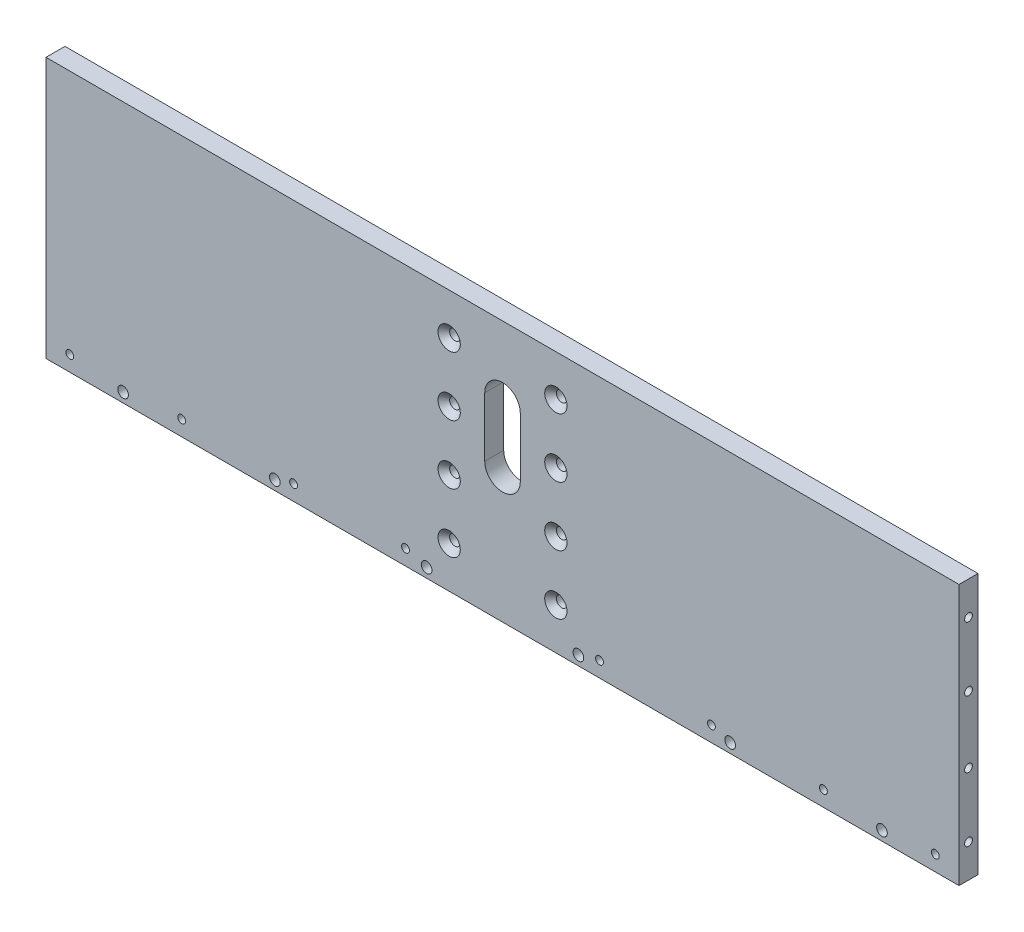
from build123d import *

# Parameters (mm, degrees)
SKETCH1_W                                       = 385
SKETCH1_H                                       = 110
EXTRUDE1_DEPTH                                  = 8
SKETCH2_R                                       = 2
CUT_EXTRUDE1_DEPTH                              = 10
CSK_FOR_M4_FLAT_HEAD_MACHINE_SCREW1_D           = 4.5
CSK_FOR_M4_FLAT_HEAD_MACHINE_SCREW1_CSINK_D     = 9.4
CSK_FOR_M4_FLAT_HEAD_MACHINE_SCREW1_CSINK_ANGLE = 90
SKETCH5_R                                       = 1.65
CUT_EXTRUDE2_DEPTH                              = 15
SKETCH6_R                                       = 2.25
CUT_EXTRUDE3_DEPTH                              = 10
CUT_EXTRUDE4_DEPTH                              = 6
CUT_EXTRUDE5_DEPTH                              = 10
CSK_FOR_M4_FLAT_HEAD_MACHINE_SCREW2_D           = 4.5
CSK_FOR_M4_FLAT_HEAD_MACHINE_SCREW2_CSINK_D     = 9.4
CSK_FOR_M4_FLAT_HEAD_MACHINE_SCREW2_CSINK_ANGLE = 90
SKETCH13_R                                      = 1.65
CUT_EXTRUDE6_DEPTH                              = 10


with BuildPart() as part:
    # Sketch1 → Extrude1 (new body)
    with BuildSketch(Plane.XY):
        Rectangle(SKETCH1_W, SKETCH1_H)
    extrude(amount=EXTRUDE1_DEPTH)

    # Sketch2 → Cut-Extrude1 (cut)
    with BuildSketch(Plane.XY.offset(8)):
        with Locations((22.5, 37.5)):
            Circle(SKETCH2_R)
        with Locations((22.5, 12.5)):
            Circle(SKETCH2_R)
        with Locations(Location((22.5, -12.5, 0), (0, 0, 180))):
            Circle(SKETCH2_R)
        with Locations((-22.5, -12.5)):
            Circle(SKETCH2_R)
        with Locations((-22.5, -37.5)):
            Circle(SKETCH2_R)
        with Locations(Location((22.5, -37.5, 0), (0, 0, 180))):
            Circle(SKETCH2_R)
        with Locations(Location((-22.5, 12.5, 0), (0, 0, 180))):
            Circle(SKETCH2_R)
        with Locations(Location((-22.5, 37.5, 0), (0, 0, 180))):
            Circle(SKETCH2_R)
    extrude(amount=-CUT_EXTRUDE1_DEPTH, mode=Mode.SUBTRACT)

    # CSK for M4 Flat Head Machine Screw1 (through all)
    with Locations(Plane.XY.offset(8)):
        with Locations((22.5, 37.5), (22.5, 12.5), (-22.5, 12.5), (-22.5, 37.5), (22.5, -12.5), (-22.5, -12.5), (-22.5, -37.5), (22.5, -37.5)):
            CounterSinkHole(CSK_FOR_M4_FLAT_HEAD_MACHINE_SCREW1_D / 2, CSK_FOR_M4_FLAT_HEAD_MACHINE_SCREW1_CSINK_D / 2, counter_sink_angle=CSK_FOR_M4_FLAT_HEAD_MACHINE_SCREW1_CSINK_ANGLE)

    # Sketch5 → Cut-Extrude2 (cut)
    with BuildSketch(Plane(origin=(192.5, 0, 0), x_dir=(0, 0, -1), z_dir=(1, 0, 0))):
        with Locations((-4, 41)):
            Circle(SKETCH5_R)
        with Locations((-4, 14)):
            Circle(SKETCH5_R)
        with Locations(Location((-4, -41, 0), (0, 0, 180))):
            Circle(SKETCH5_R)
        with Locations(Location((-4, -14, 0), (0, 0, 180))):
            Circle(SKETCH5_R)
    cut_extrude2 = extrude(amount=-CUT_EXTRUDE2_DEPTH, mode=Mode.SUBTRACT)

    # Mirror1: Cut-Extrude2 across plane
    add(cut_extrude2.mirror(Plane(origin=(0, 0, 0), x_dir=(0, 0, 1), z_dir=(1, 0, 0))), mode=Mode.SUBTRACT)

    # Sketch6 → Cut-Extrude3 (cut)
    with BuildSketch(Plane(origin=(0, 0, 0), x_dir=(-1, 0, 0), z_dir=(0, 0, -1))):
        with Locations((-96, -51)):
            Circle(SKETCH6_R)
        with Locations((-32, -51)):
            Circle(SKETCH6_R)
        with Locations((32, -51)):
            Circle(SKETCH6_R)
        with Locations((96, -51)):
            Circle(SKETCH6_R)
        with Locations((-160, -51)):
            Circle(SKETCH6_R)
        with Locations((160, -51)):
            Circle(SKETCH6_R)
    extrude(amount=-CUT_EXTRUDE3_DEPTH, mode=Mode.SUBTRACT)

    # Sketch9 → Cut-Extrude4 (cut)
    with BuildSketch(Plane(origin=(0, 0, 0), x_dir=(-1, 0, 0), z_dir=(0, 0, -1))):
        with BuildLine():
            Line((-162.5, 40), (-162.5, -40))
            ThreePointArc((-162.5, -40), (-167.5, -45), (-172.5, -40))
            Line((-172.5, -40), (-172.5, 40))
            ThreePointArc((-172.5, 40), (-167.5, 45), (-162.5, 40))
        make_face()
        with BuildLine():
            Line((-149.5, 40), (-149.5, -40))
            ThreePointArc((-149.5, -40), (-154.5, -45), (-159.5, -40))
            Line((-159.5, -40), (-159.5, 40))
            ThreePointArc((-159.5, 40), (-154.5, 45), (-149.5, 40))
        make_face()
        with BuildLine():
            Line((-136.5, 40), (-136.5, -40))
            ThreePointArc((-136.5, -40), (-141.5, -45), (-146.5, -40))
            Line((-146.5, -40), (-146.5, 40))
            ThreePointArc((-146.5, 40), (-141.5, 45), (-136.5, 40))
        make_face()
        with BuildLine():
            Line((-123.5, 40), (-123.5, -40))
            ThreePointArc((-123.5, -40), (-128.5, -45), (-133.5, -40))
            Line((-133.5, -40), (-133.5, 40))
            ThreePointArc((-133.5, 40), (-128.5, 45), (-123.5, 40))
        make_face()
        with BuildLine():
            Line((-110.5, 40), (-110.5, -40))
            ThreePointArc((-110.5, -40), (-115.5, -45), (-120.5, -40))
            Line((-120.5, -40), (-120.5, 40))
            ThreePointArc((-120.5, 40), (-115.5, 45), (-110.5, 40))
        make_face()
        with BuildLine():
            Line((-97.5, 40), (-97.5, -40))
            ThreePointArc((-97.5, -40), (-102.5, -45), (-107.5, -40))
            Line((-107.5, -40), (-107.5, 40))
            ThreePointArc((-107.5, 40), (-102.5, 45), (-97.5, 40))
        make_face()
        with BuildLine():
            Line((-84.5, 40), (-84.5, -40))
            ThreePointArc((-84.5, -40), (-89.5, -45), (-94.5, -40))
            Line((-94.5, -40), (-94.5, 40))
            ThreePointArc((-94.5, 40), (-89.5, 45), (-84.5, 40))
        make_face()
        with BuildLine():
            Line((-71.5, 40), (-71.5, -40))
            ThreePointArc((-71.5, -40), (-76.5, -45), (-81.5, -40))
            Line((-81.5, -40), (-81.5, 40))
            ThreePointArc((-81.5, 40), (-76.5, 45), (-71.5, 40))
        make_face()
        with BuildLine():
            Line((-58.5, 40), (-58.5, -40))
            ThreePointArc((-58.5, -40), (-63.5, -45), (-68.5, -40))
            Line((-68.5, -40), (-68.5, 40))
            ThreePointArc((-68.5, 40), (-63.5, 45), (-58.5, 40))
        make_face()
        with BuildLine():
            Line((-45.5, 40), (-45.5, -40))
            ThreePointArc((-45.5, -40), (-50.5, -45), (-55.5, -40))
            Line((-55.5, -40), (-55.5, 40))
            ThreePointArc((-55.5, 40), (-50.5, 45), (-45.5, 40))
        make_face()
        with BuildLine():
            Line((-32.5, 40), (-32.5, -40))
            ThreePointArc((-32.5, -40), (-37.5, -45), (-42.5, -40))
            Line((-42.5, -40), (-42.5, 40))
            ThreePointArc((-42.5, 40), (-37.5, 45), (-32.5, 40))
        make_face()
        with BuildLine():
            Line((162.5, 40), (162.5, -40))
            ThreePointArc((162.5, -40), (167.5, -45), (172.5, -40))
            Line((172.5, -40), (172.5, 40))
            ThreePointArc((172.5, 40), (167.5, 45), (162.5, 40))
        make_face()
        with BuildLine():
            Line((149.5, 40), (149.5, -40))
            ThreePointArc((149.5, -40), (154.5, -45), (159.5, -40))
            Line((159.5, -40), (159.5, 40))
            ThreePointArc((159.5, 40), (154.5, 45), (149.5, 40))
        make_face()
        with BuildLine():
            Line((136.5, 40), (136.5, -40))
            ThreePointArc((136.5, -40), (141.5, -45), (146.5, -40))
            Line((146.5, -40), (146.5, 40))
            ThreePointArc((146.5, 40), (141.5, 45), (136.5, 40))
        make_face()
        with BuildLine():
            Line((123.5, 40), (123.5, -40))
            ThreePointArc((123.5, -40), (128.5, -45), (133.5, -40))
            Line((133.5, -40), (133.5, 40))
            ThreePointArc((133.5, 40), (128.5, 45), (123.5, 40))
        make_face()
        with BuildLine():
            Line((110.5, 40), (110.5, -40))
            ThreePointArc((110.5, -40), (115.5, -45), (120.5, -40))
            Line((120.5, -40), (120.5, 40))
            ThreePointArc((120.5, 40), (115.5, 45), (110.5, 40))
        make_face()
        with BuildLine():
            Line((97.5, 40), (97.5, -40))
            ThreePointArc((97.5, -40), (102.5, -45), (107.5, -40))
            Line((107.5, -40), (107.5, 40))
            ThreePointArc((107.5, 40), (102.5, 45), (97.5, 40))
        make_face()
        with BuildLine():
            Line((84.5, 40), (84.5, -40))
            ThreePointArc((84.5, -40), (89.5, -45), (94.5, -40))
            Line((94.5, -40), (94.5, 40))
            ThreePointArc((94.5, 40), (89.5, 45), (84.5, 40))
        make_face()
        with BuildLine():
            Line((71.5, 40), (71.5, -40))
            ThreePointArc((71.5, -40), (76.5, -45), (81.5, -40))
            Line((81.5, -40), (81.5, 40))
            ThreePointArc((81.5, 40), (76.5, 45), (71.5, 40))
        make_face()
        with BuildLine():
            Line((58.5, 40), (58.5, -40))
            ThreePointArc((58.5, -40), (63.5, -45), (68.5, -40))
            Line((68.5, -40), (68.5, 40))
            ThreePointArc((68.5, 40), (63.5, 45), (58.5, 40))
        make_face()
        with BuildLine():
            Line((45.5, 40), (45.5, -40))
            ThreePointArc((45.5, -40), (50.5, -45), (55.5, -40))
            Line((55.5, -40), (55.5, 40))
            ThreePointArc((55.5, 40), (50.5, 45), (45.5, 40))
        make_face()
        with BuildLine():
            Line((32.5, 40), (32.5, -40))
            ThreePointArc((32.5, -40), (37.5, -45), (42.5, -40))
            Line((42.5, -40), (42.5, 40))
            ThreePointArc((42.5, 40), (37.5, 45), (32.5, 40))
        make_face()
    extrude(amount=-CUT_EXTRUDE4_DEPTH, mode=Mode.SUBTRACT)

    # Sketch10 → Cut-Extrude5 (cut)
    with BuildSketch(Plane.XY.offset(8)):
        with BuildLine():
            Line((-7.5, 0), (-7.5, 25))
            ThreePointArc((-7.5, 25), (0, 32.5), (7.5, 25))
            Line((7.5, 25), (7.5, 0))
            ThreePointArc((7.5, 0), (0, -7.5), (-7.5, 0))
        make_face()
    extrude(amount=-CUT_EXTRUDE5_DEPTH, mode=Mode.SUBTRACT)

    # CSK for M4 Flat Head Machine Screw2 (through all)
    with Locations(Plane(origin=(0, 0, 0), x_dir=(-1, 0, 0), z_dir=(0, 0, -1))):
        with Locations((-160, -51), (-96, -51), (-32, -51), (32, -51), (96, -51), (160, -51)):
            CounterSinkHole(CSK_FOR_M4_FLAT_HEAD_MACHINE_SCREW2_D / 2, CSK_FOR_M4_FLAT_HEAD_MACHINE_SCREW2_CSINK_D / 2, counter_sink_angle=CSK_FOR_M4_FLAT_HEAD_MACHINE_SCREW2_CSINK_ANGLE)

    # Sketch13 → Cut-Extrude6 (cut)
    with BuildSketch(Plane(origin=(0, 0, 0), x_dir=(-1, 0, 0), z_dir=(0, 0, -1))):
        with Locations((-182.5, -48.5)):
            Circle(SKETCH13_R)
        with Locations((-135.3, -48.5)):
            Circle(SKETCH13_R)
        with Locations((-88.1, -48.5)):
            Circle(SKETCH13_R)
        with Locations((-40.9, -48.5)):
            Circle(SKETCH13_R)
        with Locations((40.9, -48.5)):
            Circle(SKETCH13_R)
        with Locations((88.1, -48.5)):
            Circle(SKETCH13_R)
        with Locations((135.3, -48.5)):
            Circle(SKETCH13_R)
        with Locations((182.5, -48.5)):
            Circle(SKETCH13_R)
    extrude(amount=-CUT_EXTRUDE6_DEPTH, mode=Mode.SUBTRACT)


solid = part.part
